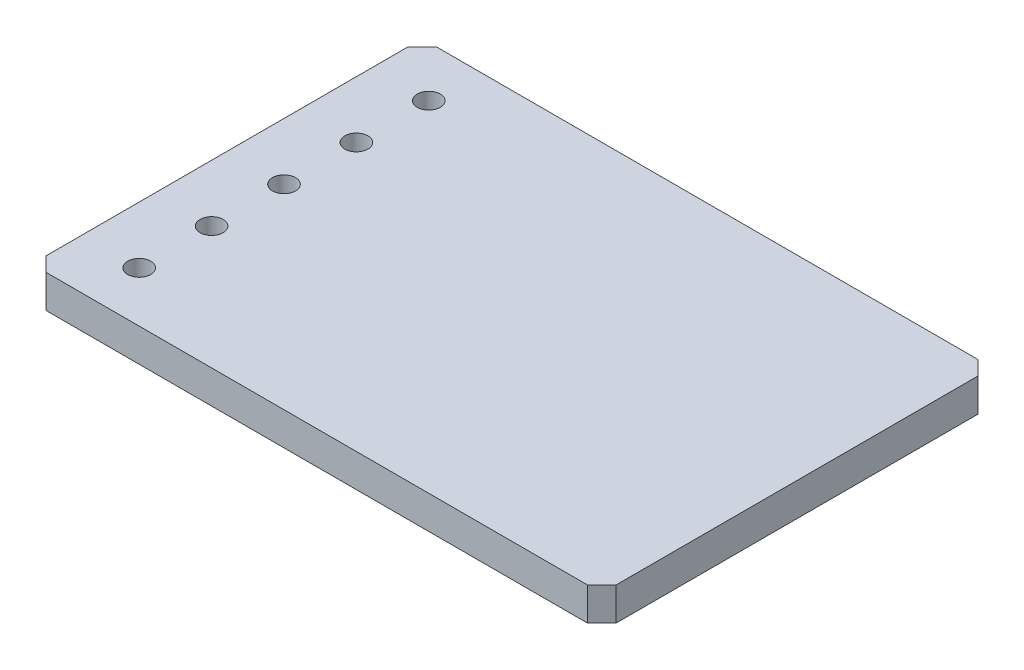
from build123d import *

# Parameters (mm, degrees)
SKETCH1_W           = 20
SKETCH1_H           = 13.7
SKETCH1_R           = 0.405
BOSS_EXTRUDE1_DEPTH = 1.16
CHAMFER1_SIZE       = 0.5


with BuildPart() as part:
    # Sketch1 → Boss-Extrude1 (new body)
    with BuildSketch(Plane(origin=(0, 0, 0), x_dir=(1, 0, 0), z_dir=(0, 1, 0))):
        Rectangle(SKETCH1_W, SKETCH1_H)
        with Locations(Location((-8, -5.08, 0), (0, 0, 270))):
            Circle(SKETCH1_R, mode=Mode.SUBTRACT)
        with Locations(Location((-8, -2.54, 0), (0, 0, 270))):
            Circle(SKETCH1_R, mode=Mode.SUBTRACT)
        with Locations(Location((-8, 0, 0), (0, 0, 270))):
            Circle(SKETCH1_R, mode=Mode.SUBTRACT)
        with Locations(Location((-8, 2.54, 0), (0, 0, 270))):
            Circle(SKETCH1_R, mode=Mode.SUBTRACT)
        with Locations(Location((-8, 5.08, 0), (0, 0, 270))):
            Circle(SKETCH1_R, mode=Mode.SUBTRACT)
    extrude(amount=BOSS_EXTRUDE1_DEPTH)

    # Chamfer1
    chamfer1_edges = [part.edges().sort_by_distance(p)[0] for p in [
        (-10, 0.58, -6.85),
        (10, 0.58, -6.85),
        (10, 0.58, 6.85),
        (-10, 0.58, 6.85),
    ]]
    chamfer(chamfer1_edges, length=CHAMFER1_SIZE)


solid = part.part
